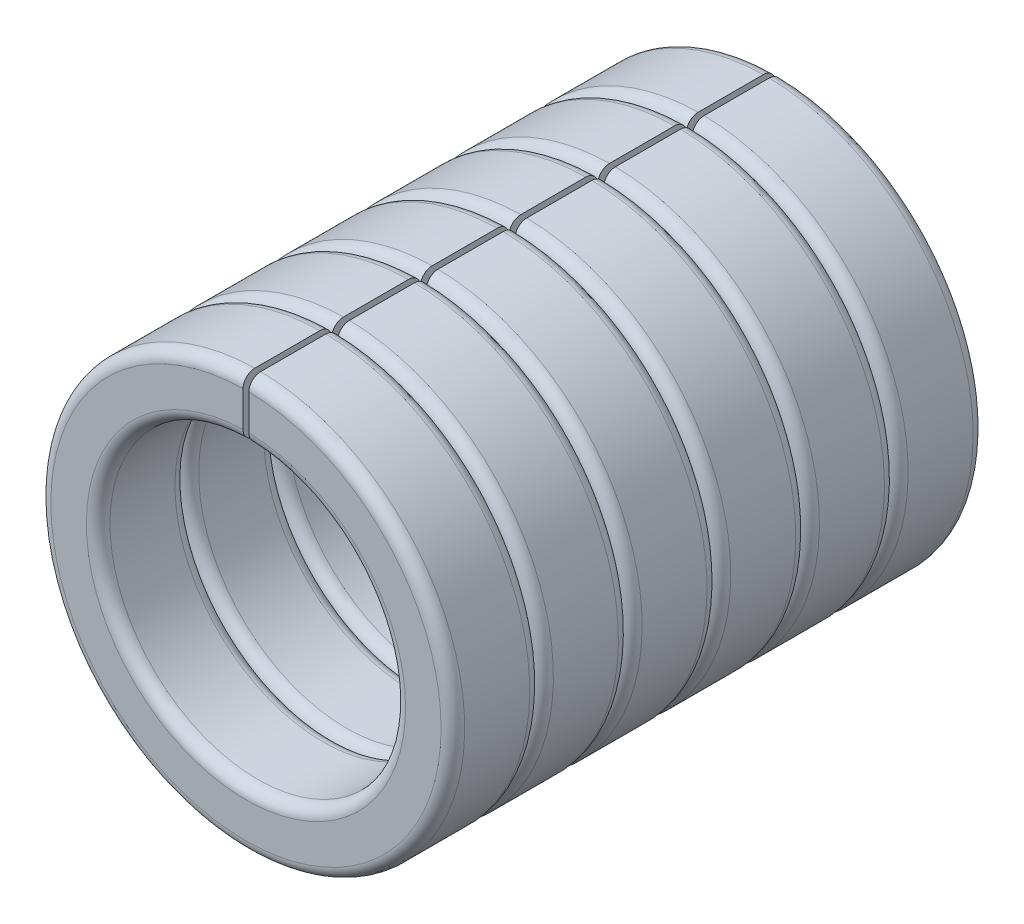
from build123d import *

# Parameters (mm, degrees)
SKETCH3_W          = 1
SKETCH3_H          = 76.137854622
CUT_EXTRUDE1_DEPTH = 20
LPATTERN1_COUNT    = 7
LPATTERN1_PITCH    = 15


with BuildPart() as part:
    # Sketch2 → Revolve1 (revolve)
    with BuildSketch(Plane(origin=(0, 0, 0), x_dir=(1, 0, 0), z_dir=(0, 1, 0)), mode=Mode.PRIVATE) as revolve1_sk:
        with BuildLine():
            Line((-27, 0.7), (-33, 0.7))
            ThreePointArc((-33, 0.7), (-34.414213562, 1.285786438), (-35, 2.7))
            Line((-35, 2.7), (-35, 13.7))
            ThreePointArc((-35, 13.7), (-34.414213562, 15.114213562), (-33, 15.7))
            Line((-33, 15.7), (-27, 15.7))
            ThreePointArc((-27, 15.7), (-25.585786438, 15.114213562), (-25, 13.7))
            Line((-25, 13.7), (-25, 2.7))
            ThreePointArc((-25, 2.7), (-25.585786438, 1.285786438), (-27, 0.7))
        make_face()
    revolve1 = revolve(revolve1_sk.sketch.rotate(Axis((0, 0, 0), (0, 0, -1)), 180), axis=Axis((0, 0, 0), (0, 0, -1)))

    # Sketch3 → Cut-Extrude1 (cut)
    with BuildSketch(Plane.XY.offset(-0.7)):
        with Locations((0, 37.124385567)):
            Rectangle(SKETCH3_W, SKETCH3_H)
    cut_extrude1 = extrude(amount=-CUT_EXTRUDE1_DEPTH, mode=Mode.SUBTRACT)

    # LPattern1: Revolve1, Cut-Extrude1 ×7, 1 skipped
    with Locations(*[(0, 0, -i * LPATTERN1_PITCH) for i in range(1, LPATTERN1_COUNT) if i not in (6,)]):
        add(revolve1)
        add(cut_extrude1, mode=Mode.SUBTRACT)


solid = part.part
